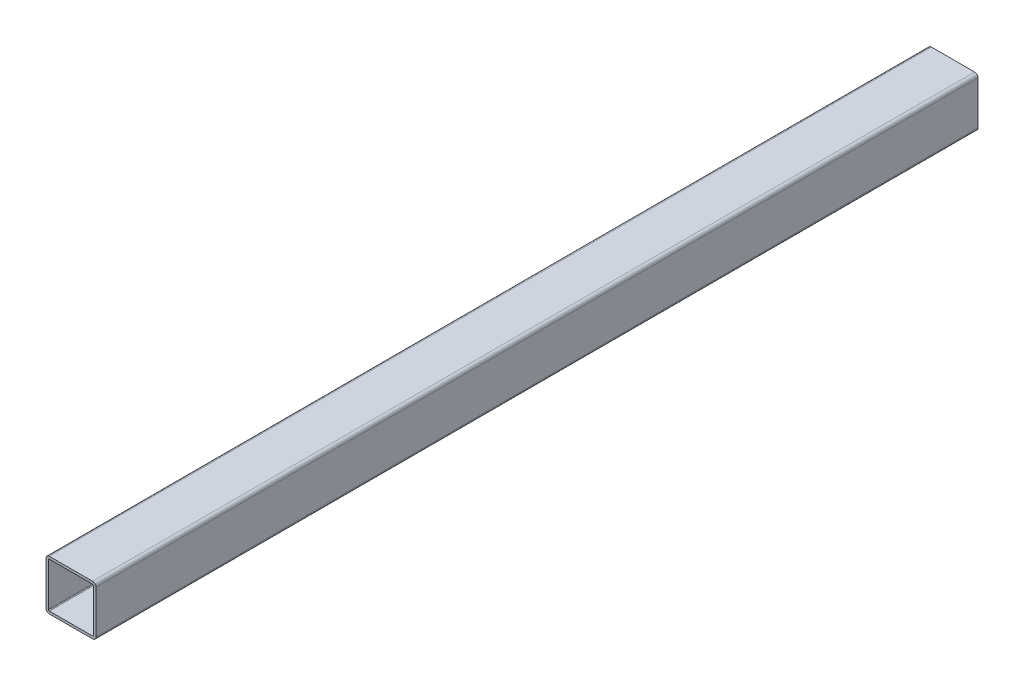
from build123d import *

# Parameters (mm, degrees)
EXTRUDE_1_DEPTH = 530


with BuildPart() as part:
    # Эскиз1 → Вытянуть-Тонкостенный1 (new body)
    with BuildSketch(Plane.XY):
        with BuildLine():
            Line((0, 28), (0, 2))
            ThreePointArc((0, 2), (0.585786438, 0.585786438), (2, 0))
            Line((2, 0), (28, 0))
            ThreePointArc((28, 0), (29.414213562, 0.585786438), (30, 2))
            Line((30, 2), (30, 28))
            ThreePointArc((30, 28), (29.414213562, 29.414213562), (28, 30))
            Line((28, 30), (2, 30))
            ThreePointArc((2, 30), (0.585786438, 29.414213562), (0, 28))
        make_face()
        with BuildLine():
            Line((1.5, 28), (1.5, 2))
            ThreePointArc((1.5, 2), (1.646446609, 1.646446609), (2, 1.5))
            Line((2, 1.5), (28, 1.5))
            ThreePointArc((28, 1.5), (28.353553391, 1.646446609), (28.5, 2))
            Line((28.5, 2), (28.5, 28))
            ThreePointArc((28.5, 28), (28.353553391, 28.353553391), (28, 28.5))
            Line((28, 28.5), (2, 28.5))
            ThreePointArc((2, 28.5), (1.646446609, 28.353553391), (1.5, 28))
        make_face(mode=Mode.SUBTRACT)
    extrude(amount=EXTRUDE_1_DEPTH)


solid = part.part
